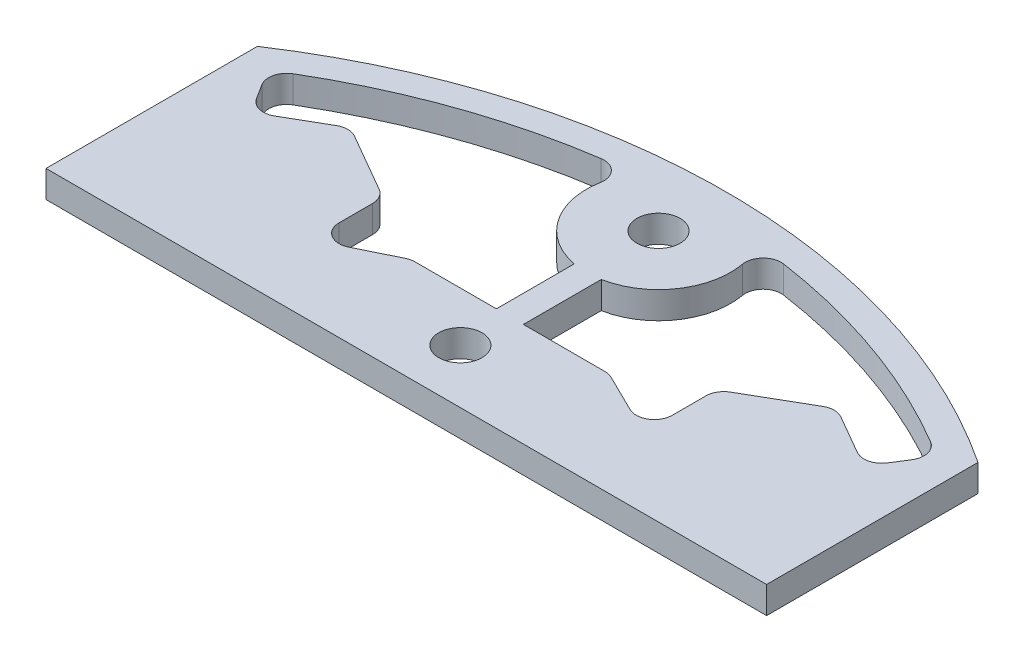
from build123d import *

# Parameters (mm, degrees)
BOSS_EXTRUDE1_DEPTH  = 3
CUT_EXTRUDE12_DEPTH  = 103.574363269
SKETCH11_OUTSIDE_W   = 186.736
SKETCH11_OUTSIDE_H   = 177.534
SKETCH11_OUTSIDE_W_2 = 80
SKETCH11_OUTSIDE_H_2 = 40
CUT_EXTRUDE13_DEPTH  = 103.574363269
SKETCH12_R           = 2.4
CUT_EXTRUDE15_DEPTH  = 83.856804186
SKETCH13_W           = 3
SKETCH13_H           = 13.331578006
BOSS_EXTRUDE2_DEPTH  = 3


with BuildPart() as part:
    # Sketch1 → Boss-Extrude1 (new body)
    with BuildSketch(Plane(origin=(0, 0, 0), x_dir=(1, 0, 0), z_dir=(0, 1, 0))):
        with BuildLine():
            ThreePointArc((36.543377003, -62.616544118), (0, 72.5), (-36.543377003, -62.616544118))
            ThreePointArc((-36.543377003, -62.616544118), (-33.085954668, -63.20954405), (-30.089832649, -61.38507948))
            ThreePointArc((-30.089832649, -61.38507948), (0, -46.75), (30.089832649, -61.38507948))
            ThreePointArc((30.089832649, -61.38507948), (33.085954668, -63.20954405), (36.543377003, -62.616544118))
        make_face()
    extrude(amount=BOSS_EXTRUDE1_DEPTH)

    # Sketch10 → Cut-Extrude12 (cut, through all)
    with BuildSketch(Plane.XZ):
        with BuildLine():
            Line((-18.5, -48.031932838), (-18.5, -51.75277675))
            ThreePointArc((-18.5, -51.75277675), (-18.767949192, -52.75277675), (-19.5, -53.484827557))
            Line((-19.5, -53.484827557), (-26, -57.237604307))
            ThreePointArc((-26, -57.237604307), (-27, -57.505553499), (-28, -57.237604307))
            Line((-28, -57.237604307), (-32.336247441, -54.73407068))
            ThreePointArc((-32.336247441, -54.73407068), (-33.814934269, -54.524251533), (-35.026688711, -55.397286461))
            Line((-35.026688711, -55.397286461), (-36.057344072, -57.027343779))
            ThreePointArc((-36.057344072, -57.027343779), (-36.311279162, -58.56458095), (-35.385181403, -59.817547066))
            ThreePointArc((-35.385181403, -59.817547066), (-23.193446557, -65.515754112), (-10.132084292, -68.757478632))
            ThreePointArc((-10.132084292, -68.757478632), (-8.40348615, -68.169871795), (-7.872410817, -66.423076923))
            ThreePointArc((-7.872410817, -66.423076923), (0, -57), (7.872410817, -66.423076923))
            ThreePointArc((7.872410817, -66.423076923), (8.40348615, -68.169871795), (10.132084292, -68.757478632))
            ThreePointArc((10.132084292, -68.757478632), (23.193446557, -65.515754112), (35.385181403, -59.817547066))
            ThreePointArc((35.385181403, -59.817547066), (36.311279162, -58.56458095), (36.057344072, -57.027343779))
            Line((36.057344072, -57.027343779), (35.026688711, -55.397286461))
            ThreePointArc((35.026688711, -55.397286461), (33.814934269, -54.524251533), (32.336247441, -54.73407068))
            Line((32.336247441, -54.73407068), (28, -57.237604307))
            ThreePointArc((28, -57.237604307), (27, -57.505553499), (26, -57.237604307))
            Line((26, -57.237604307), (19.5, -53.484827557))
            ThreePointArc((19.5, -53.484827557), (18.767949192, -52.75277675), (18.5, -51.75277675))
            Line((18.5, -51.75277675), (18.5, -48.031932838))
            ThreePointArc((18.5, -48.031932838), (17.558247208, -46.334843316), (15.619887154, -46.235992589))
            Line((15.619887154, -46.235992589), (11.416400149, -48.295940249))
            ThreePointArc((11.416400149, -48.295940249), (10.988017035, -48.448317287), (10.536287302, -48.5))
            Line((10.536287302, -48.5), (-10.536287302, -48.5))
            ThreePointArc((-10.536287302, -48.5), (-10.988017035, -48.448317287), (-11.416400149, -48.295940249))
            Line((-11.416400149, -48.295940249), (-15.619887154, -46.235992589))
            ThreePointArc((-15.619887154, -46.235992589), (-17.558247208, -46.334843316), (-18.5, -48.031932838))
        make_face()
    extrude(amount=-CUT_EXTRUDE12_DEPTH, mode=Mode.SUBTRACT)

    # Sketch11 outside → Cut-Extrude13 (cut, through all)
    with BuildSketch(Plane.XZ):
        with Locations((0, -4.601)):
            Rectangle(SKETCH11_OUTSIDE_W, SKETCH11_OUTSIDE_H)
        with Locations((0, -57)):
            Rectangle(SKETCH11_OUTSIDE_W_2, SKETCH11_OUTSIDE_H_2, mode=Mode.SUBTRACT)
    extrude(amount=-CUT_EXTRUDE13_DEPTH, mode=Mode.SUBTRACT)

    # Sketch12 → Cut-Extrude15 (cut, through all)
    with BuildSketch(Plane.XZ):
        with Locations(Location((0, -65, 0), (0, 0, 270))):
            Circle(SKETCH12_R)
        with Locations(Location((0, -43, 0), (0, 0, 270))):
            Circle(SKETCH12_R)
    extrude(amount=-CUT_EXTRUDE15_DEPTH, mode=Mode.SUBTRACT)

    # Sketch13 → Boss-Extrude2 (add)
    with BuildSketch(Plane.XZ):
        with Locations((0, -53.718139369)):
            Rectangle(SKETCH13_W, SKETCH13_H)
    extrude(amount=-BOSS_EXTRUDE2_DEPTH)


solid = part.part
